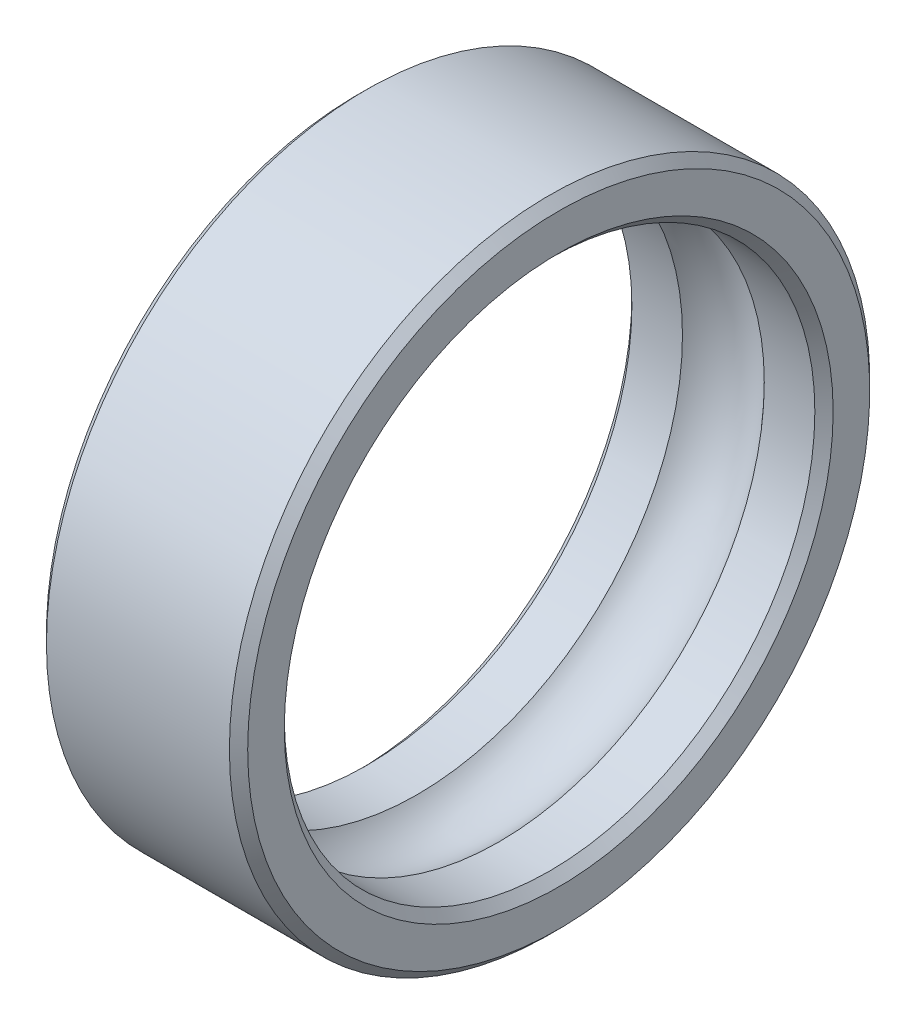
from build123d import *

# Parameters (mm, degrees)
CHAMFER1_SIZE = 0.5
CHAMFER2_SIZE = 0.5


with BuildPart() as part:
    # Sketch1 → Revolve1 (revolve)
    with BuildSketch(Plane.XY, mode=Mode.PRIVATE) as revolve1_sk:
        with BuildLine():
            Line((5.5, 14.5), (2.236067977, 14.5))
            ThreePointArc((2.236067977, 14.5), (0, 15.5), (-2.236067977, 14.5))
            Line((-2.236067977, 14.5), (-5.5, 14.5))
            Line((-5.5, 14.5), (-5.5, 17.5))
            Line((-5.5, 17.5), (5.5, 17.5))
            Line((5.5, 17.5), (5.5, 14.5))
        make_face()
    revolve(revolve1_sk.sketch.rotate(Axis((-7.5, 0, 0), (1, 0, 0)), 90), axis=Axis((-7.5, 0, 0), (1, 0, 0)))

    # Chamfer1
    chamfer1_edges = [part.edges().sort_by_distance(p)[0] for p in [
        (5.5, 0, -17.5),
        (-5.5, 0, -17.5),
    ]]
    chamfer(chamfer1_edges, length=CHAMFER1_SIZE)

    # Chamfer2
    chamfer2_edges = [part.edges().sort_by_distance(p)[0] for p in [
        (-5.5, 0, -14.5),
        (5.5, 0, -14.5),
    ]]
    chamfer(chamfer2_edges, length=CHAMFER2_SIZE)


solid = part.part
